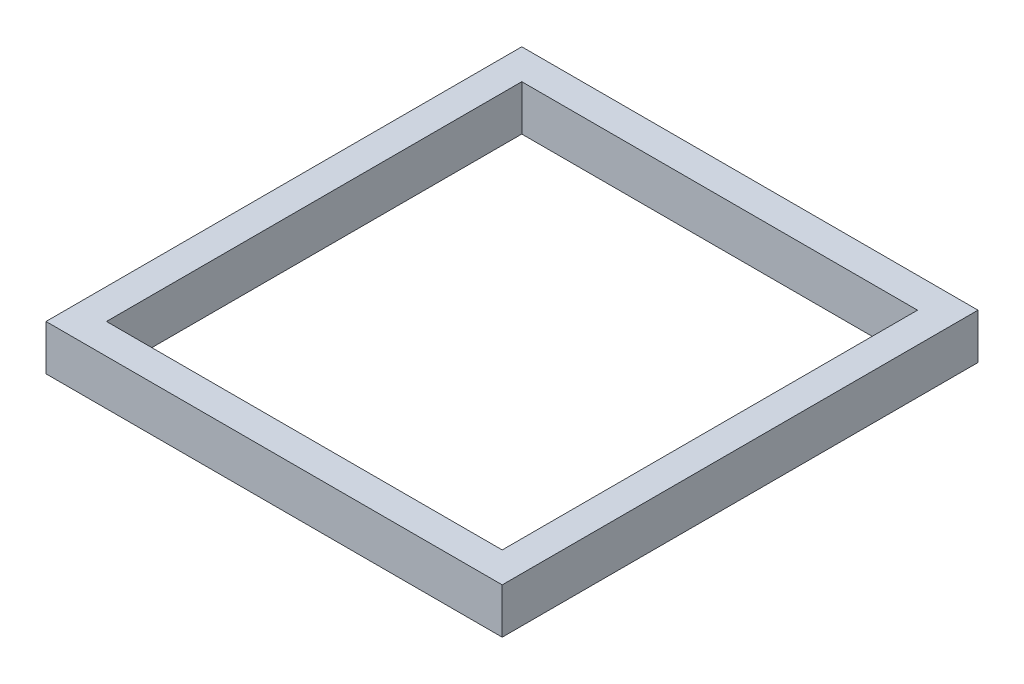
from build123d import *

# Parameters (mm, degrees)
SKETCH1_W           = 52.35
SKETCH1_H           = 54.94
BOSS_EXTRUDE1_DEPTH = 6


with BuildPart() as part:
    # Sketch1 → Boss-Extrude1 (new body)
    with BuildSketch(Plane(origin=(0, 0, 0), x_dir=(1, 0, 0), z_dir=(0, 1, 0))):
        Polygon((4, -54.94), (4, 4), (-52.35, 4), (-56.35, 4), (-56.35, 0), (-56.35, -58.94), (0, -58.94), (4, -58.94), align=None)
        with Locations((-26.175, -27.47)):
            Rectangle(SKETCH1_W, SKETCH1_H, mode=Mode.SUBTRACT)
    extrude(amount=BOSS_EXTRUDE1_DEPTH)


solid = part.part
